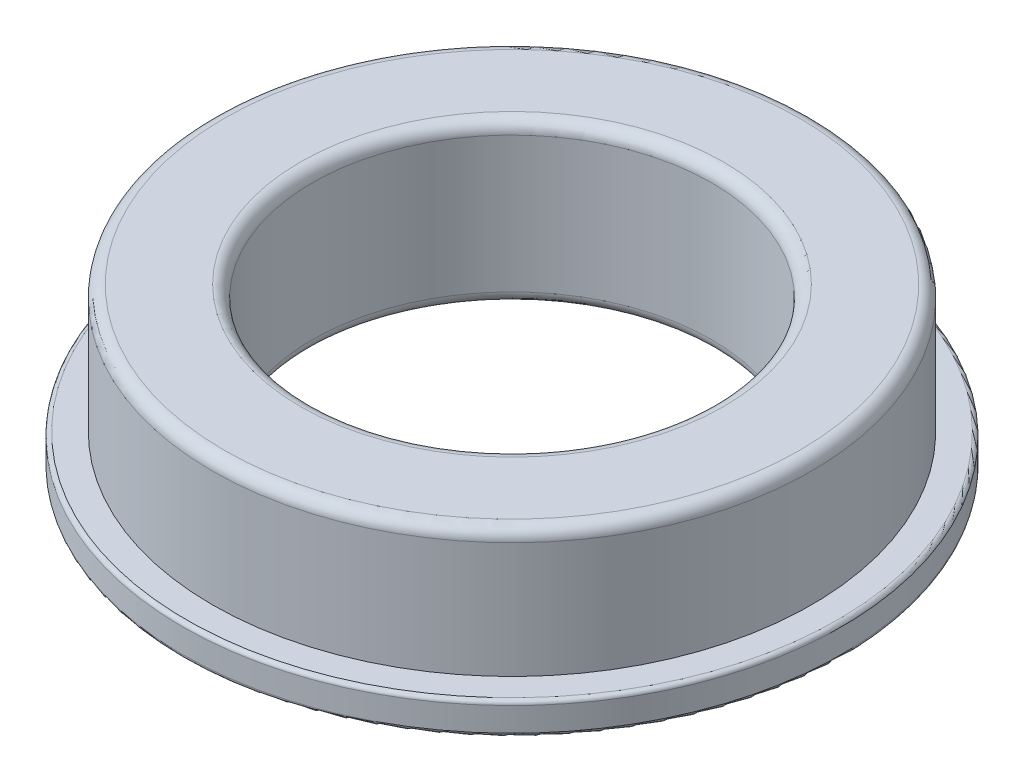
from build123d import *

# Parameters (mm, degrees)
SKETCH1_R           = 7.5
SKETCH1_R_2         = 5
BOSS_EXTRUDE1_DEPTH = 4
SKETCH2_R           = 8.25
SKETCH2_R_2         = 5
BOSS_EXTRUDE2_DEPTH = 0.8
FILLET1_R           = 0.3
FILLET2_R           = 0.1


with BuildPart() as part:
    # Sketch1 → Boss-Extrude1 (new body)
    with BuildSketch(Plane(origin=(0, 0, 0), x_dir=(1, 0, 0), z_dir=(0, 1, 0))):
        with Locations(Location((0, 0, 0), (0, 0, 270))):
            Circle(SKETCH1_R)
        with Locations(Location((0, 0, 0), (0, 0, 270))):
            Circle(SKETCH1_R_2, mode=Mode.SUBTRACT)
    extrude(amount=BOSS_EXTRUDE1_DEPTH)

    # Sketch2 → Boss-Extrude2 (add)
    with BuildSketch(Plane.XZ):
        with Locations(Location((0, 0, 0), (0, 0, 270))):
            Circle(SKETCH2_R)
        with Locations(Location((0, 0, 0), (0, 0, 90))):
            Circle(SKETCH2_R_2, mode=Mode.SUBTRACT)
    extrude(amount=-BOSS_EXTRUDE2_DEPTH)

    # Fillet1
    fillet1_edges = [part.edges().sort_by_distance(p)[0] for p in [
        (0, 4, -7.5),
        (0, 0, -5),
        (0, 4, -5),
    ]]
    fillet(fillet1_edges, radius=FILLET1_R)

    # Fillet2
    fillet2_edges = [part.edges().sort_by_distance(p)[0] for p in [
        (0, 0, 8.25),
        (0, 0.8, 8.25),
    ]]
    fillet(fillet2_edges, radius=FILLET2_R)


solid = part.part
